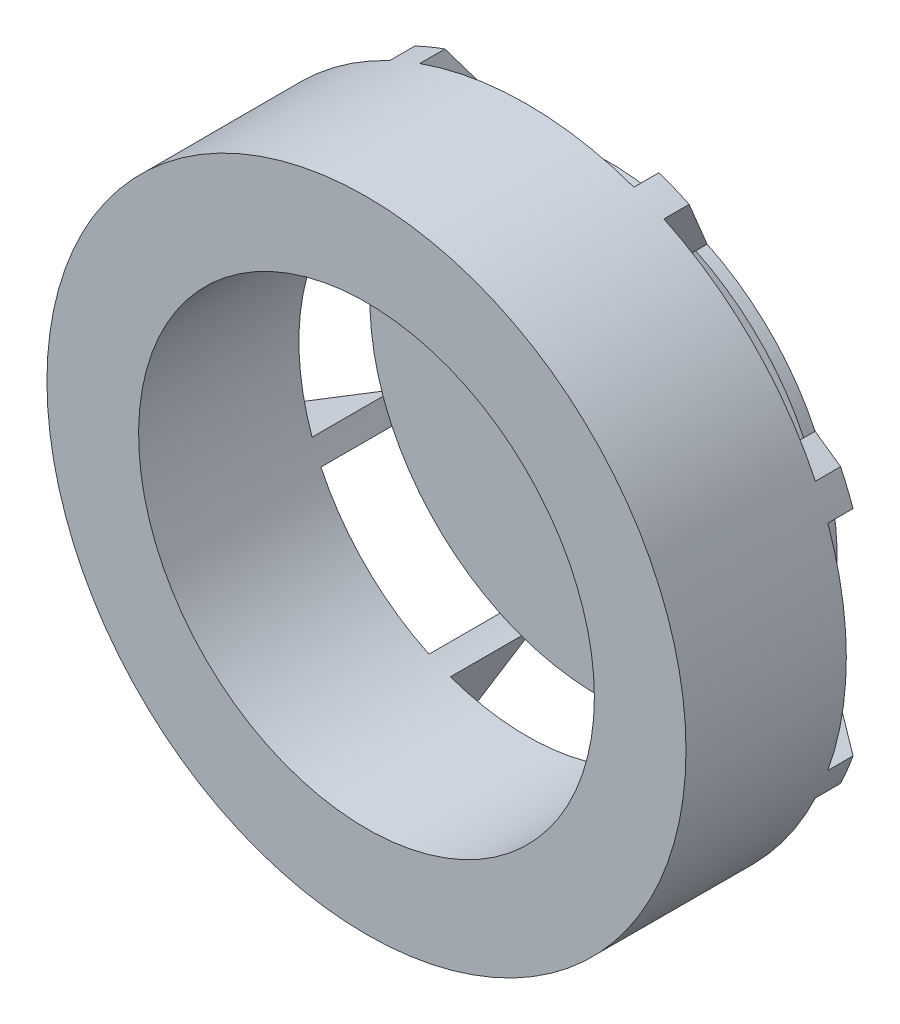
from build123d import *

# Parameters (mm, degrees)
IZIM1_R                     = 13.95
Y_KSEKLIK_EKSTR_ZYON1_DEPTH = 10.6
PAH1_SIZE                   = 4
PAH1_SIZE2                  = 2.5
IZIM3_R                     = 2.5
KES_EKSTR_ZYON1_DEPTH       = 10.6
KES_EKSTR_ZYON2_DEPTH       = 3.6
DAIRESEL_KAPLAMA1_COUNT     = 8
KES_EKSTR_ZYON3_DEPTH       = 10.1


with BuildPart() as part:
    # Çizim1 → Yükseklik-Ekstrüzyon1 (new body)
    with BuildSketch(Plane.XY):
        Circle(IZIM1_R)
    extrude(amount=Y_KSEKLIK_EKSTR_ZYON1_DEPTH)

    # Pah1
    pah1_edges = [part.edges().sort_by_distance(p)[0] for p in [
        (-13.95, 0, 0),
    ]]
    pah1_side = [part.faces().sort_by_distance(p)[0] for p in [
        (0, 0, 0),
    ]]
    chamfer(pah1_edges, length=PAH1_SIZE, length2=PAH1_SIZE2, reference=pah1_side[0])

    # Çizim3 → Kes-Ekstrüzyon1 (cut)
    with BuildSketch(Plane.XY.offset(10.6)):
        Circle(IZIM3_R)
    extrude(amount=-KES_EKSTR_ZYON1_DEPTH, mode=Mode.SUBTRACT)

    # Çizim5 → Kes-Ekstrüzyon2 (cut)
    with BuildSketch(Plane(origin=(0, 0, 0), x_dir=(-1, 0, 0), z_dir=(0, 0, -1))):
        with BuildLine():
            Line((-9.374663228, 3.334394903), (-13.143372063, 4.674855165))
            ThreePointArc((-13.143372063, 4.674855165), (-13.95, 0), (-13.143372063, -4.674855165))
            Line((-13.143372063, -4.674855165), (-9.374663228, -3.334394903))
            ThreePointArc((-9.374663228, -3.334394903), (-9.95, 0), (-9.374663228, 3.334394903))
        make_face()
    kes_ekstr_zyon2 = extrude(amount=-KES_EKSTR_ZYON2_DEPTH, mode=Mode.SUBTRACT)

    # Dairesel Kaplama1: Kes-Ekstrüzyon2 ×8 about axis
    dairesel_kaplama1_axis = Axis((0, 0, 0), (0, 0, 1))
    for i in range(1, DAIRESEL_KAPLAMA1_COUNT):
        add(kes_ekstr_zyon2.rotate(dairesel_kaplama1_axis, i * 360 / DAIRESEL_KAPLAMA1_COUNT), mode=Mode.SUBTRACT)

    # Çizim8 → Kes-Ekstrüzyon3 (cut)
    with BuildSketch(Plane(origin=(0, 0, 0.5), x_dir=(-1, 0, 0), z_dir=(0, 0, -1))):
        with BuildLine():
            ThreePointArc((-9.374663228, -3.334394903), (-9.192601348, -3.807700152), (-8.986661187, -4.271114693))
            ThreePointArc((-8.986661187, -4.271114693), (-7.035712473, -7.035712473), (-4.271114693, -8.986661187))
            ThreePointArc((-4.271114693, -8.986661187), (-3.807700152, -9.192601348), (-3.334394903, -9.374663228))
            ThreePointArc((-3.334394903, -9.374663228), (0, -9.95), (3.334394903, -9.374663228))
            ThreePointArc((3.334394903, -9.374663228), (3.807700152, -9.192601348), (4.271114693, -8.986661187))
            ThreePointArc((4.271114693, -8.986661187), (7.035712473, -7.035712473), (8.986661187, -4.271114693))
            ThreePointArc((8.986661187, -4.271114693), (9.192601348, -3.807700152), (9.374663228, -3.334394903))
            ThreePointArc((9.374663228, -3.334394903), (9.95, 0), (9.374663228, 3.334394903))
            ThreePointArc((9.374663228, 3.334394903), (9.192601348, 3.807700152), (8.986661187, 4.271114693))
            ThreePointArc((8.986661187, 4.271114693), (7.035712473, 7.035712473), (4.271114693, 8.986661187))
            ThreePointArc((4.271114693, 8.986661187), (3.807700152, 9.192601348), (3.334394903, 9.374663228))
            ThreePointArc((3.334394903, 9.374663228), (0, 9.95), (-3.334394903, 9.374663228))
            ThreePointArc((-3.334394903, 9.374663228), (-3.807700152, 9.192601348), (-4.271114693, 8.986661187))
            ThreePointArc((-4.271114693, 8.986661187), (-7.035712473, 7.035712473), (-8.986661187, 4.271114693))
            ThreePointArc((-8.986661187, 4.271114693), (-9.192601348, 3.807700152), (-9.374663228, 3.334394903))
            ThreePointArc((-9.374663228, 3.334394903), (-9.95, 0), (-9.374663228, -3.334394903))
        make_face()
    extrude(amount=-KES_EKSTR_ZYON3_DEPTH, mode=Mode.SUBTRACT)


solid = part.part
